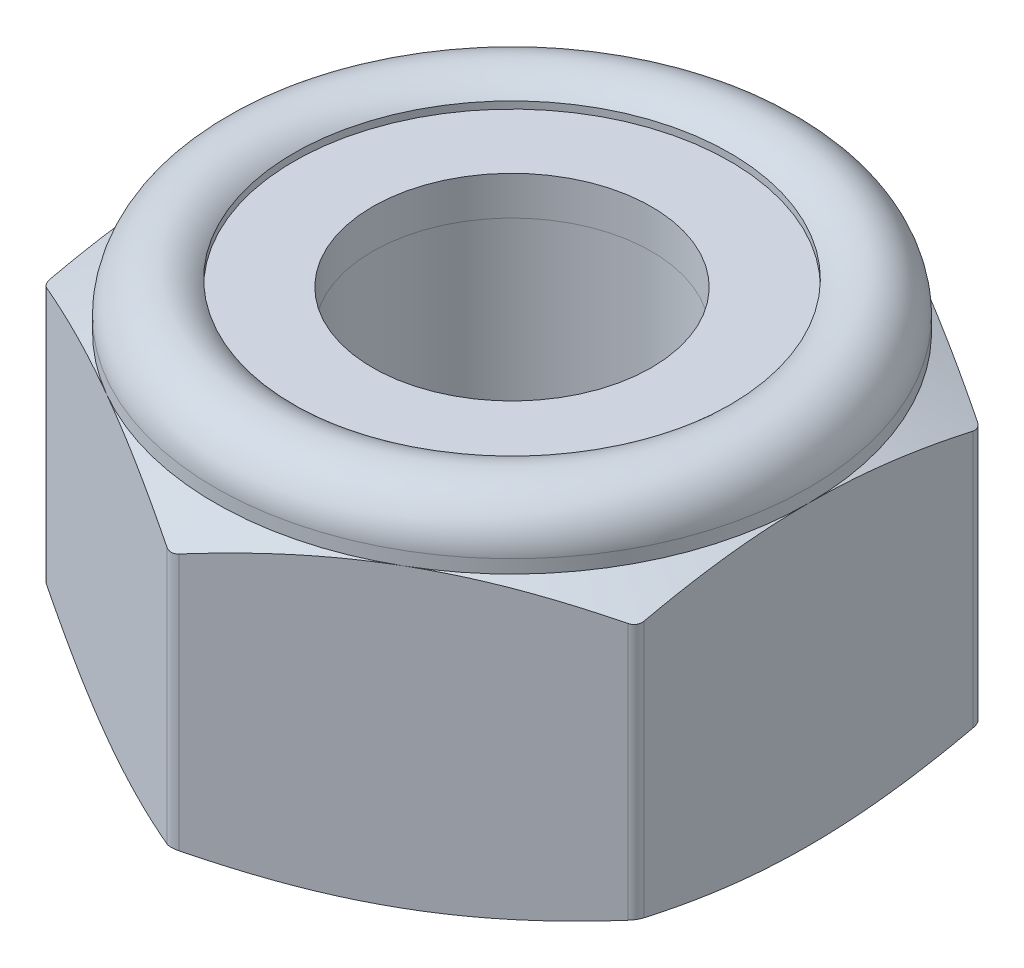
from build123d import *

# Parameters (mm, degrees)
BOSS_EXTRUDE1_DEPTH      = 3
BOSS_EXTRUDE1_DEPTH_BACK = 3
SKETCH2_R                = 2.350480947
FILLET1_R                = 0.2
SKETCH4_W                = 1.324759527
SKETCH4_H                = 0.652707199


with BuildPart() as part:
    # Sketch2 → Boss-Extrude1 (new, two sides: drawn at the far end of the back side and taken through both)
    with BuildSketch(Plane(origin=(0, 0, 0), x_dir=(1, 0, 0), z_dir=(0, 1, 0)).offset(-BOSS_EXTRUDE1_DEPTH_BACK)):
        Polygon((0, 5.773502692), (-5, 2.886751346), (-5, -2.886751346), (0, -5.773502692), (5, -2.886751346), (5, 2.886751346), align=None)
        with Locations(Location((0, 0, 0), (0, 0, 270))):
            Circle(SKETCH2_R, mode=Mode.SUBTRACT)
    extrude(amount=BOSS_EXTRUDE1_DEPTH + BOSS_EXTRUDE1_DEPTH_BACK)

    # Fillet1
    fillet1_edges = [part.edges().sort_by_distance(p)[0] for p in [
        (5, 0, -2.886751346),
        (5, 0, 2.886751346),
        (0, 0, 5.773502692),
        (-5, 0, 2.886751346),
        (-5, 0, -2.886751346),
        (0, 0, -5.773502692),
    ]]
    fillet(fillet1_edges, radius=FILLET1_R)

    # Sketch3 → Cut-Revolve2 (revolve, cut)
    with BuildSketch(Plane(origin=(0, 0, 0), x_dir=(0, 0, -1), z_dir=(1, 0, 0)), mode=Mode.PRIVATE) as cut_revolve2_sk:
        with BuildLine():
            Line((5.773502692, 2), (5.773502692, 4))
            Line((5.773502692, 4), (2.350480947, 4))
            Line((2.350480947, 4), (2.350480947, 2))
            Line((2.350480947, 2), (3.675240474, 2))
            Line((3.675240474, 2), (3.675240474, 2.772707199))
            ThreePointArc((3.675240474, 2.772707199), (4.520946192, 2.940928526), (5, 2.223973836))
            Line((5, 2.223973836), (5, 2))
            Line((5, 2), (5.773502692, 1.639309771))
            Line((5.773502692, 1.639309771), (5.773502692, 2))
        make_face()
        Polygon((5, -3), (5.773502692, -2.639309771), (5.773502692, -3), align=None)
        Polygon((2.350480947, -3), (2.350480947, -2.4), (2.950480947, -3), align=None)
    revolve(cut_revolve2_sk.sketch.rotate(Axis((0, -3, 0), (0, 1, 0)), 270), axis=Axis((0, -3, 0), (0, 1, 0)), mode=Mode.SUBTRACT)


with BuildPart() as body_2:
    # Sketch4 → Revolve1 (revolve)
    with BuildSketch(Plane(origin=(0, 0, 0), x_dir=(0, 0, -1), z_dir=(1, 0, 0)), mode=Mode.PRIVATE) as revolve1_sk:
        with Locations((-3.012860711, 2.326353599)):
            Rectangle(SKETCH4_W, SKETCH4_H)
    revolve(revolve1_sk.sketch.rotate(Axis((0, -3, 0), (0, 1, 0)), 90), axis=Axis((0, -3, 0), (0, 1, 0)))


solid = Compound([part.part, body_2.part])
